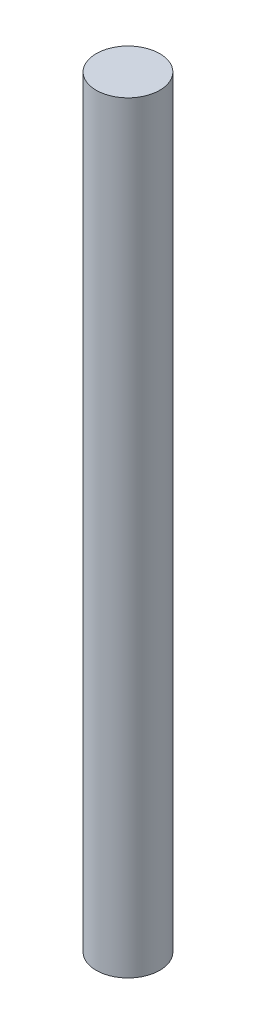
from build123d import *

# Parameters (mm, degrees)
SKETCH1_R           = 4
BOSS_EXTRUDE1_DEPTH = 96


with BuildPart() as part:
    # Sketch1 → Boss-Extrude1 (new body)
    with BuildSketch(Plane(origin=(0, 0, 0), x_dir=(1, 0, 0), z_dir=(0, 1, 0))):
        with Locations(Location((0, 0, 0), (0, 0, 270))):
            Circle(SKETCH1_R)
    extrude(amount=BOSS_EXTRUDE1_DEPTH)


solid = part.part
